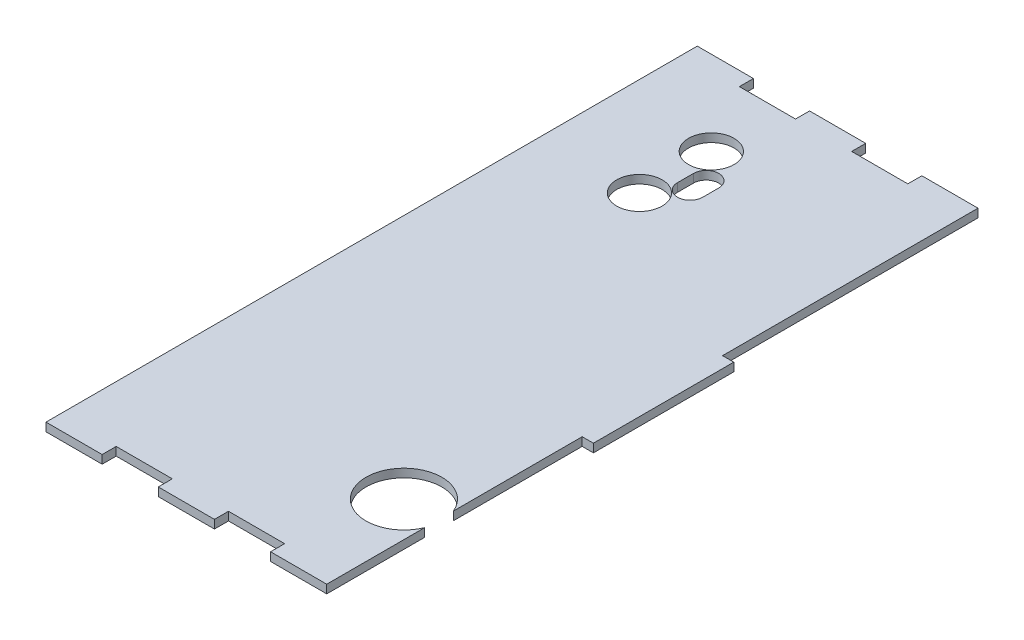
from build123d import *

# Parameters (mm, degrees)
SKETCH1_R           = 8.1
BOSS_EXTRUDE1_DEPTH = 3


with BuildPart() as part:
    # Sketch1 → Boss-Extrude1 (new body)
    with BuildSketch(Plane(origin=(0, 0, 0), x_dir=(1, 0, 0), z_dir=(0, 1, 0))):
        with BuildLine():
            Line((-50, -111), (-50, -116))
            Line((-50, -116), (-30, -116))
            Line((-30, -116), (-30, -111))
            Line((-30, -111), (-10, -111))
            Line((-10, -111), (-10, -116))
            Line((-10, -116), (10, -116))
            Line((10, -116), (10, -111))
            Line((10, -111), (30, -111))
            Line((30, -111), (30, -116))
            Line((30, -116), (50, -116))
            Line((50, -116), (50, -111))
            Line((50, -111), (50, -81.099019514))
            ThreePointArc((50, -81.099019514), (24, -76), (50, -70.900980486))
            Line((50, -70.900980486), (50, -25))
            Line((50, -25), (54, -25))
            Line((54, -25), (54, 25))
            Line((54, 25), (50, 25))
            Line((50, 25), (50, 111))
            Line((50, 111), (50, 116))
            Line((50, 116), (30, 116))
            Line((30, 116), (30, 111))
            Line((30, 111), (10, 111))
            Line((10, 111), (10, 116))
            Line((10, 116), (-10, 116))
            Line((-10, 116), (-10, 111))
            Line((-10, 111), (-30, 111))
            Line((-30, 111), (-30, 116))
            Line((-30, 116), (-50, 116))
            Line((-50, 116), (-50, 111))
            Line((-50, 111), (-50, -111))
        make_face()
        with Locations(Location((-15, 60.4, 0), (0, 0, 270))):
            Circle(SKETCH1_R, mode=Mode.SUBTRACT)
        with Locations(Location((-15, 86, 0), (0, 0, 270))):
            Circle(SKETCH1_R, mode=Mode.SUBTRACT)
        with BuildLine():
            Line((-11.4, 70.35), (-11.4, 76.05))
            ThreePointArc((-11.4, 76.05), (-6.9, 80.55), (-2.4, 76.05))
            Line((-2.4, 76.05), (-2.4, 70.35))
            ThreePointArc((-2.4, 70.35), (-6.9, 65.85), (-11.4, 70.35))
        make_face(mode=Mode.SUBTRACT)
    extrude(amount=BOSS_EXTRUDE1_DEPTH)


solid = part.part
